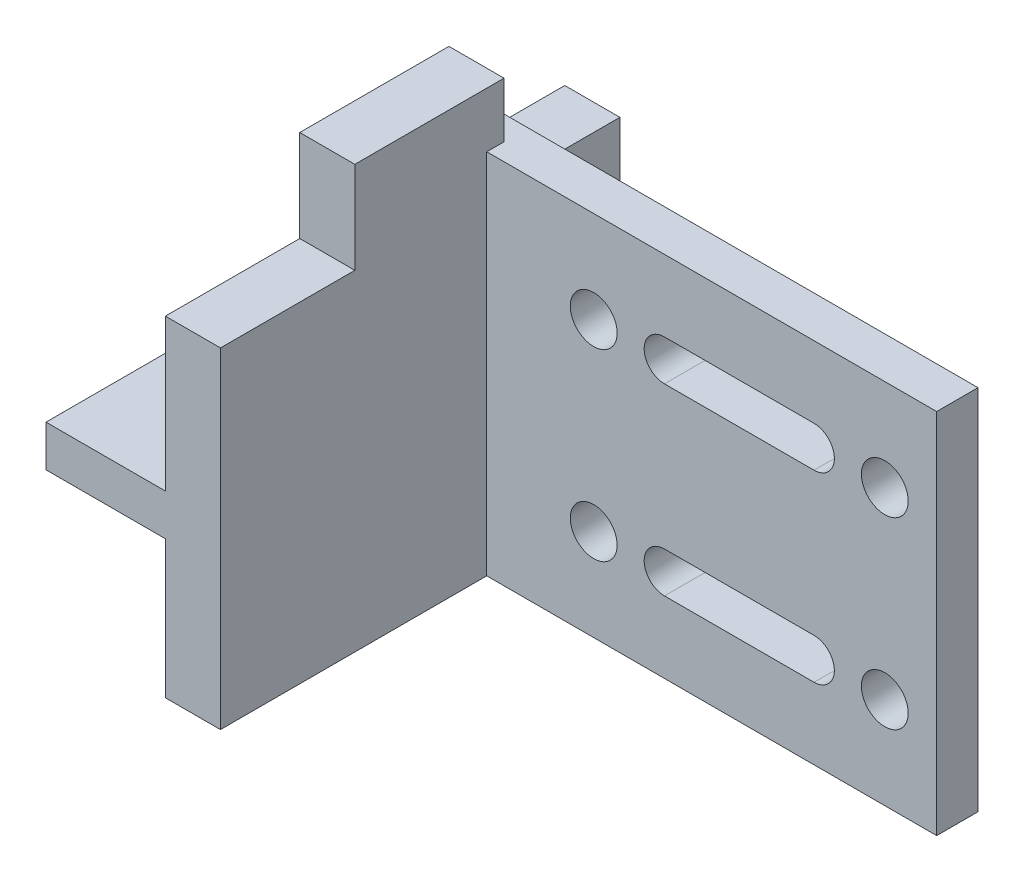
from build123d import *

# Parameters (mm, degrees)
SKETCH_1_R          = 2.55
EXTRUDE_1_DEPTH     = 4.5
SKETCH_2_W          = 6
SKETCH_2_H          = 20
EXTRUDE_2_DEPTH     = 29
SKETCH_5_W          = 33.5
SKETCH_5_H          = 4.5
EXTRUDE_4_DEPTH     = 13
SKETCH_6_R          = 1.5
CUT_EXTRUDE_1_DEPTH = 13
SKETCH_8_W          = 6
SKETCH_8_H          = 20
EXTRUDE_5_DEPTH     = 10
SKETCH_11_W         = 6
SKETCH_11_H         = 43.5
EXTRUDE_7_DEPTH     = 30
SKETCH_17_W         = 6
SKETCH_17_H         = 43.5
CUT_EXTRUDE_3_DEPTH = 14
SKETCH_18_W         = 6
SKETCH_18_H         = 16.247997213
EXTRUDE_12_DEPTH    = 10
SKETCH_20_W         = 15
SKETCH_20_H         = 4.5
EXTRUDE_13_DEPTH    = 15
SKETCH_22_R         = 1.5
CUT_EXTRUDE_5_DEPTH = 15
SKETCH_23_W         = 13
SKETCH_23_H         = 33.5
CUT_EXTRUDE_6_DEPTH = 15
SKETCH_24_R         = 1.5
CUT_EXTRUDE_7_DEPTH = 15


with BuildPart() as part:
    # 草图1 → 凸台-拉伸1 (new body)
    with BuildSketch(Plane.XY):
        Polygon((-27.5, -10), (21.5, -10), (21.5, 10), (-27.5, 10), (-33.5, 10), (-33.5, -10), align=None)
        with Locations((-15.85, 0)):
            Circle(SKETCH_1_R, mode=Mode.SUBTRACT)
        with Locations((15.85, 0)):
            Circle(SKETCH_1_R, mode=Mode.SUBTRACT)
        with BuildLine():
            Line((-8.144701861, 2.212014563), (8.144701861, 2.212014563))
            ThreePointArc((8.144701861, 2.212014563), (10.356716424, 0), (8.144701861, -2.212014563))
            Line((8.144701861, -2.212014563), (-8.144701861, -2.212014563))
            ThreePointArc((-8.144701861, -2.212014563), (-10.356716424, 0), (-8.144701861, 2.212014563))
        make_face(mode=Mode.SUBTRACT)
    extrude_1 = extrude(amount=EXTRUDE_1_DEPTH)

    # 草图2 → 凸台-拉伸2 (add)
    with BuildSketch(Plane.XY.offset(4.5)):
        with Locations((-30.5, 0)):
            Rectangle(SKETCH_2_W, SKETCH_2_H)
    extrude(amount=EXTRUDE_2_DEPTH)

    # 草图5 → 凸台-拉伸4 (add)
    with BuildSketch(Plane.ZY.offset(33.5)):
        with Locations((16.75, -7.75)):
            Rectangle(SKETCH_5_W, SKETCH_5_H)
        with Locations((16.75, 7.25)):
            Rectangle(SKETCH_5_W, SKETCH_5_H)
    extrude(amount=EXTRUDE_4_DEPTH)

    # 草图6 → 切除-拉伸1 (cut)
    with BuildSketch(Plane.XZ.offset(10)):
        with Locations((-39.2, 1.6)):
            Circle(SKETCH_6_R)
        with Locations((-39.2, 10.6)):
            Circle(SKETCH_6_R)
    extrude(amount=-CUT_EXTRUDE_1_DEPTH, mode=Mode.SUBTRACT)

    # 草图8 → 凸台-拉伸5 (add)
    with BuildSketch(Plane(origin=(0, 0, 0), x_dir=(-1, 0, 0), z_dir=(0, 0, -1))):
        with Locations((30.5, 0)):
            Rectangle(SKETCH_8_W, SKETCH_8_H)
    extrude(amount=EXTRUDE_5_DEPTH)

    # 草图11 → 凸台-拉伸7 (add)
    with BuildSketch(Plane(origin=(0, 10, 0), x_dir=(1, 0, 0), z_dir=(0, 1, 0))):
        with Locations((-30.5, -11.75)):
            Rectangle(SKETCH_11_W, SKETCH_11_H)
    extrude(amount=EXTRUDE_7_DEPTH)

    # 草图17 → 切除-拉伸3 (cut)
    with BuildSketch(Plane(origin=(0, 40, 0), x_dir=(1, 0, 0), z_dir=(0, 1, 0))):
        with Locations((-30.5, -11.75)):
            Rectangle(SKETCH_17_W, SKETCH_17_H)
    extrude(amount=-CUT_EXTRUDE_3_DEPTH, mode=Mode.SUBTRACT)

    # 草图18 → 凸台-拉伸12 (add)
    with BuildSketch(Plane(origin=(0, 26, 0), x_dir=(1, 0, 0), z_dir=(0, 1, 0))):
        with Locations((-30.5, -10.74216301)):
            Rectangle(SKETCH_18_W, SKETCH_18_H)
    extrude(amount=EXTRUDE_12_DEPTH)

    # 镜向1: 凸台-拉伸1 across plane
    add(extrude_1.mirror(Plane.ZX.offset(10)))

    # 草图20 → 凸台-拉伸13 (add)
    with BuildSketch(Plane.ZY.offset(33.5)):
        with Locations((-7.5, 7.25)):
            Rectangle(SKETCH_20_W, SKETCH_20_H)
    extrude(amount=EXTRUDE_13_DEPTH)

    # 草图22 → 切除-拉伸5 (cut)
    with BuildSketch(Plane.XZ.offset(-5)):
        with Locations((-39.2, 10.6)):
            Circle(SKETCH_22_R)
        with Locations((-39.2, 1.6)):
            Circle(SKETCH_22_R)
    extrude(amount=-CUT_EXTRUDE_5_DEPTH, mode=Mode.SUBTRACT)

    # 草图23 → 切除-拉伸6 (cut)
    with BuildSketch(Plane.XZ.offset(10)):
        with Locations((-40, 16.75)):
            Rectangle(SKETCH_23_W, SKETCH_23_H)
    extrude(amount=-CUT_EXTRUDE_6_DEPTH, mode=Mode.SUBTRACT)

    # 草图24 → 切除-拉伸7 (cut)
    with BuildSketch(Plane.XZ.offset(-5)):
        with Locations(Location((-39.19836294, -7.4, 0), (0, 0, 270))):
            Circle(SKETCH_24_R)
    extrude(amount=-CUT_EXTRUDE_7_DEPTH, mode=Mode.SUBTRACT)


solid = part.part
